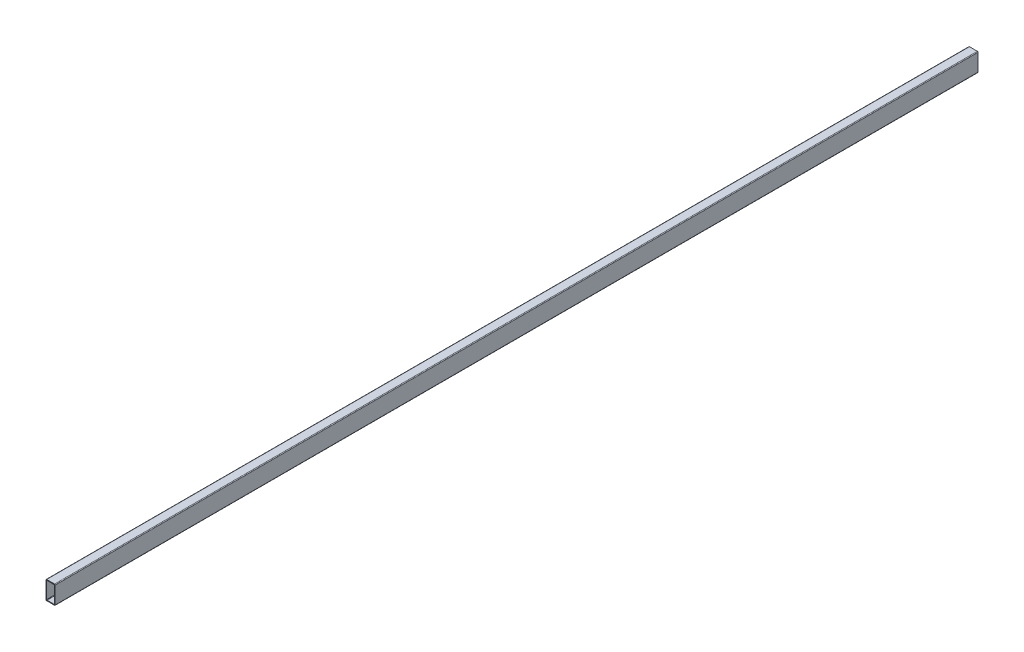
from build123d import *

# Parameters (mm, degrees)
EXTRUDE_1_DEPTH = 1000


with BuildPart() as part:
    # Эскиз1 → Бобышка-Вытянуть1 (new body)
    with BuildSketch(Plane.XY):
        with BuildLine():
            Line((0, 38.5), (0, 1.5))
            ThreePointArc((0, 1.5), (0.439339828, 0.439339828), (1.5, 0))
            Line((1.5, 0), (18.5, 0))
            ThreePointArc((18.5, 0), (19.560660172, 0.439339828), (20, 1.5))
            Line((20, 1.5), (20, 38.5))
            ThreePointArc((20, 38.5), (19.560660172, 39.560660172), (18.5, 40))
            Line((18.5, 40), (1.5, 40))
            ThreePointArc((1.5, 40), (0.439339828, 39.560660172), (0, 38.5))
        make_face()
        with BuildLine():
            Line((1.5, 37.5), (1.5, 2.5))
            ThreePointArc((1.5, 2.5), (1.792893219, 1.792893219), (2.5, 1.5))
            Line((2.5, 1.5), (17.5, 1.5))
            ThreePointArc((17.5, 1.5), (18.207106781, 1.792893219), (18.5, 2.5))
            Line((18.5, 2.5), (18.5, 37.5))
            ThreePointArc((18.5, 37.5), (18.207106781, 38.207106781), (17.5, 38.5))
            Line((17.5, 38.5), (2.5, 38.5))
            ThreePointArc((2.5, 38.5), (1.792893219, 38.207106781), (1.5, 37.5))
        make_face(mode=Mode.SUBTRACT)
    extrude_1 = extrude(amount=EXTRUDE_1_DEPTH)

    # Зеркальное отражение1: Бобышка-Вытянуть1 across plane
    add(extrude_1.mirror(Plane(origin=(18.5, 38.5, 0), x_dir=(1, 0, 0), z_dir=(0, 0, -1))))


solid = part.part
